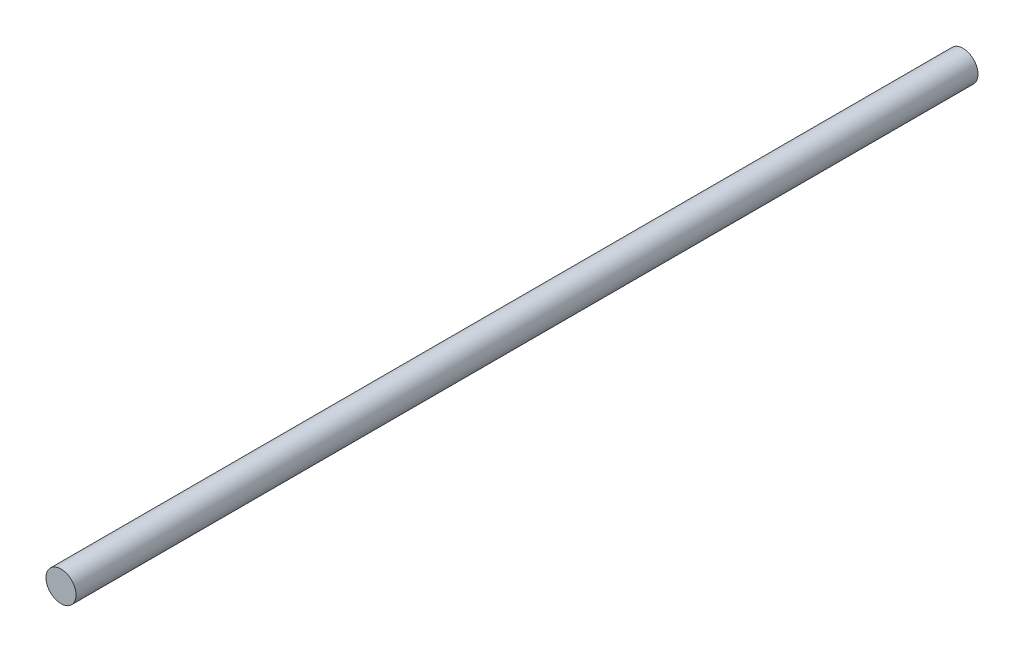
from build123d import *

# Parameters (mm, degrees)
SKETCH_1_R      = 2.5
EXTRUDE_1_DEPTH = 150


with BuildPart() as part:
    # 草图1 → 凸台-拉伸1 (new body)
    with BuildSketch(Plane.XY):
        Circle(SKETCH_1_R)
    extrude(amount=EXTRUDE_1_DEPTH)


solid = part.part
